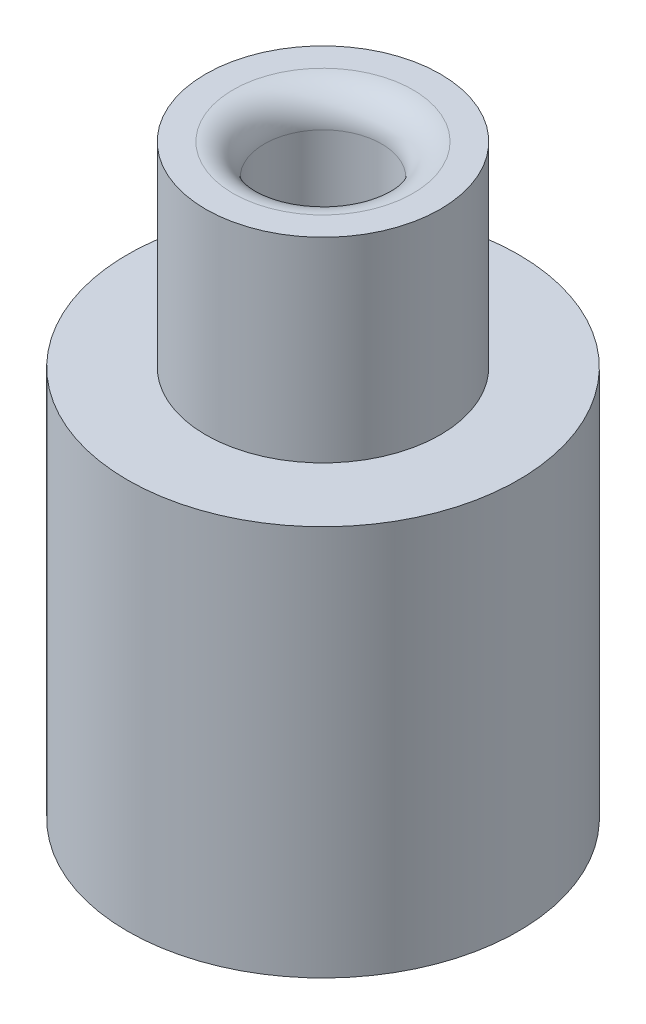
from build123d import *

# Parameters (mm, degrees)
BOSS_EXTRU_1_DEPTH      = 6
BOSS_EXTRU_1_DEPTH_BACK = 4
ESQUISSE1_R             = 5
BOSS_EXTRU_2_DEPTH      = 5
BOSS_EXTRU_2_DEPTH_BACK = 1
ESQUISSE2_R             = 3
ESQUISSE3_R             = 1.5
ENL_V_MAT_EXTRU_2_DEPTH = 6
ESQUISSE4_R             = 2.5
ENL_V_MAT_EXTRU_3_DEPTH = 5
CONG_1_R                = 0.8


with BuildPart() as part:
    # Esquisse1 → Boss.-Extru.1 (new, two sides: drawn at the far end of the back side and taken through both)
    with BuildSketch(Plane(origin=(0, 0, 0), x_dir=(1, 0, 0), z_dir=(0, 1, 0)).offset(-BOSS_EXTRU_1_DEPTH_BACK)):
        with Locations(Location((0, 0, 0), (0, 0, 270))):
            Circle(ESQUISSE1_R)
    extrude(amount=BOSS_EXTRU_1_DEPTH + BOSS_EXTRU_1_DEPTH_BACK)

    # Esquisse2 → Boss.-Extru.2 (add, two sides: drawn at the far end of the back side and taken through both)
    with BuildSketch(Plane(origin=(0, 6, 0), x_dir=(1, 0, 0), z_dir=(0, 1, 0)).offset(-BOSS_EXTRU_2_DEPTH_BACK)):
        with Locations(Location((0, 0, 0), (0, 0, 270))):
            Circle(ESQUISSE2_R)
    extrude(amount=BOSS_EXTRU_2_DEPTH + BOSS_EXTRU_2_DEPTH_BACK)

    # Esquisse3 → Enlèv. mat.-Extru.2 (cut)
    with BuildSketch(Plane(origin=(0, 11, 0), x_dir=(1, 0, 0), z_dir=(0, 1, 0))):
        with Locations(Location((0, 0, 0), (0, 0, 270))):
            Circle(ESQUISSE3_R)
    extrude(amount=-ENL_V_MAT_EXTRU_2_DEPTH, mode=Mode.SUBTRACT)

    # Esquisse4 → Enlèv. mat.-Extru.3 (cut)
    with BuildSketch(Plane.XZ.offset(4)):
        with Locations(Location((0, 0, 0), (0, 0, 270))):
            Circle(ESQUISSE4_R)
    extrude(amount=-ENL_V_MAT_EXTRU_3_DEPTH, mode=Mode.SUBTRACT)

    # Congé1
    cong_1_edges = [part.edges().sort_by_distance(p)[0] for p in [
        (0, 11, -1.5),
    ]]
    fillet(cong_1_edges, radius=CONG_1_R)


solid = part.part
